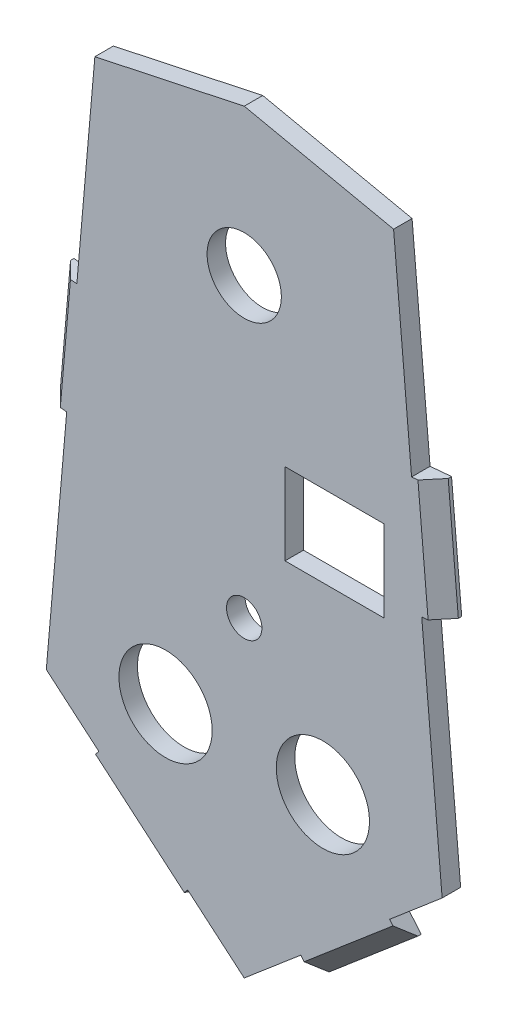
from build123d import *

# Parameters (mm, degrees)
BOSS_EXTRUDE2_DEPTH = 3.175
CHAMFER3_SIZE       = 2.6
SKETCH3_R           = 8
SKETCH3_R_2         = 3.03324197
SKETCH3_R_3         = 6.375
SKETCH3_W           = 17
SKETCH3_H           = 14
CUT_EXTRUDE1_DEPTH  = 10


with BuildPart() as part:
    # Sketch2 → Boss-Extrude2 (new body)
    with BuildSketch(Plane.XY):
        Polygon((33.967630838, -35.823456397), (25.63439182, 59.425901431), (0, 64.888689731), (-25.63439182, 59.425901431), (-33.967630838, -35.823456397), (0, -64.691310269), align=None)
        Polygon((-30.464841537, 4.213608519), (-28.721726682, 24.137502481), (-32.407647065, 24.459978729), (-34.15076192, 4.536084767), align=None)
        Polygon((32.407647065, 24.459978729), (28.721726682, 24.137502481), (30.464841537, 4.213608519), (34.15076192, 4.536084767), align=None)
        Polygon((27.2046006, -46.164342336), (24.938042288, -43.497375254), (9.698230388, -56.449137036), (11.9647887, -59.116104119), align=None)
        Polygon((-9.698230388, -56.449137036), (-24.938042288, -43.497375254), (-27.2046006, -46.164342336), (-11.9647887, -59.116104119), align=None)
    extrude(amount=BOSS_EXTRUDE2_DEPTH)

    # Chamfer3
    chamfer3_edges = [part.edges().sort_by_distance(p)[0] for p in [
        (19.58469465, -52.640223227, 3.175),
        (33.279204493, 14.498031748, 3.175),
        (-33.279204493, 14.498031748, 3.175),
        (-19.58469465, -52.640223227, 3.175),
    ]]
    chamfer(chamfer3_edges, length=CHAMFER3_SIZE)

    # Sketch3 → Cut-Extrude1 (cut)
    with BuildSketch(Plane.XY.offset(3.175)):
        with Locations((13.5, -30.691310269)):
            Circle(SKETCH3_R)
        with Locations((-13.5, -30.691310269)):
            Circle(SKETCH3_R)
        with Locations((0, -11.191310269)):
            Circle(SKETCH3_R_2)
        with Locations((0, 39.734509442)):
            Circle(SKETCH3_R_3)
        with Locations((15.5, 7.808689731)):
            Rectangle(SKETCH3_W, SKETCH3_H)
    extrude(amount=-CUT_EXTRUDE1_DEPTH, mode=Mode.SUBTRACT)


solid = part.part
